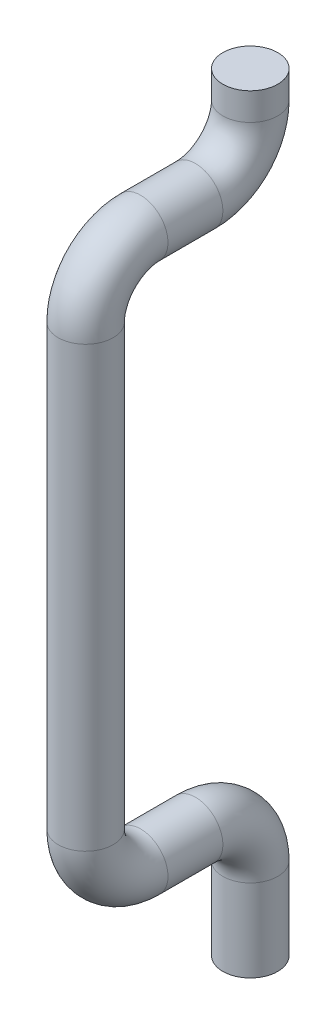
from build123d import *

# Parameters (mm, degrees)
SKETCH2_R = 1


with BuildPart() as part:
    # Sweep1: sweep along a path in Sketch1
    with BuildLine(Plane(origin=(0, 0, 0), x_dir=(0, 0, -1), z_dir=(1, 0, 0))) as sweep1_path:
        Line((15.22, -2), (15.22, 1))
        ThreePointArc((15.22, 1), (14.634213562, 2.414213562), (13.22, 3))
        Line((13.22, 3), (11.22, 3))
        ThreePointArc((11.22, 3), (9.805786438, 3.585786438), (9.22, 5))
        Line((9.22, 5), (9.22, 21))
        ThreePointArc((9.22, 21), (9.805786438, 22.414213562), (11.22, 23))
        Line((11.22, 23), (13.22, 23))
        ThreePointArc((13.22, 23), (14.634213562, 23.585786438), (15.22, 25))
        Line((15.22, 25), (15.22, 26))
    # Sketch2 → Sweep1 (sweep)
    with BuildSketch(Plane(origin=(0, -2, 0), x_dir=(1, 0, 0), z_dir=(0, 1, 0))):
        with Locations((0, 15.22)):
            Circle(SKETCH2_R)
    sweep(path=sweep1_path.line)


solid = part.part
